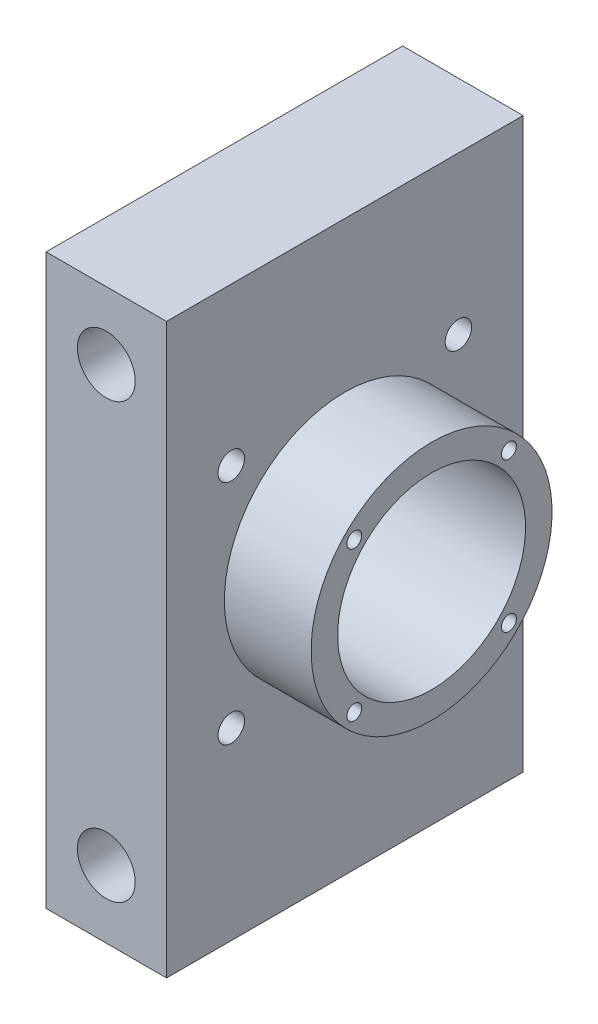
from build123d import *

# Parameters (mm, degrees)
BOSS_EXTRUDE1_DEPTH      = 320
SKETCH2_W                = 25
SKETCH2_H                = 100
BOSS_EXTRUDE2_DEPTH      = 50
CUT_EXTRUDE1_DEPTH       = 337.19190948
CUT_EXTRUDE1_DEPTH_BACK  = 337.19190948
SKETCH3_R                = 5
SKETCH4_W                = 150
SKETCH4_H                = 19.211352241
BOSS_EXTRUDE3_DEPTH      = 100
BOSS_EXTRUDE4_DEPTH      = 100
SKETCH6_W                = 42.1
SKETCH6_H                = 42.1
CUT_EXTRUDE2_DEPTH       = 10
SKETCH7_R                = 11
CUT_EXTRUDE3_DEPTH       = 2
CUT_EXTRUDE4_DEPTH       = 391.24267
CUT_EXTRUDE4_DEPTH_BACK  = 391.24267
SKETCH8_R                = 11
SKETCH10_R               = 25
SKETCH10_R_2             = 11
BOSS_EXTRUDE5_DEPTH      = 18
CUT_EXTRUDE6_DEPTH       = 381.347658714
CUT_EXTRUDE6_DEPTH_BACK  = 381.347658714
BOSS_EXTRUDE6_REACH      = 243.332
SKETCH12_W               = 150
SKETCH12_H               = 15
SKETCH13_W               = 165
SKETCH13_H               = 5
BOSS_EXTRUDE7_DEPTH      = 100
CUT_EXTRUDE7_DEPTH       = 282.821411126
CUT_EXTRUDE7_DEPTH_BACK  = 282.821411126
SKETCH16_W               = 62.5
SKETCH16_H               = 22.206056974
CUT_EXTRUDE9_DEPTH       = 298.574684732
SKETCH17_W               = 62.5
SKETCH17_H               = 5
BOSS_EXTRUDE8_DEPTH      = 15
SKETCH18_W               = 62.5
SKETCH18_H               = 11.362446971
BOSS_EXTRUDE9_DEPTH      = 15
SKETCH19_W               = 25
SKETCH19_H               = 100
BOSS_EXTRUDE11_DEPTH     = 9
SKETCH20_R               = 5
CUT_EXTRUDE10_DEPTH      = 62.5
SKETCH21_R               = 6
CUT_EXTRUDE11_DEPTH      = 62.5
CUT_EXTRUDE12_DEPTH      = 7
CUT_EXTRUDE14_DEPTH      = 261.438787644
CUT_EXTRUDE14_DEPTH_BACK = 261.438787644
SKETCH23_OUTSIDE_W       = 346.597
SKETCH23_OUTSIDE_H       = 164.386
SKETCH23_OUTSIDE_W_2     = 50
SKETCH23_OUTSIDE_H_2     = 100
CUT_EXTRUDE15_DEPTH      = 115.564392374
CUT_EXTRUDE15_DEPTH_BACK = 115.564392374
SKETCH24_R               = 6
SKETCH25_W               = 25
SKETCH25_H               = 5
BOSS_EXTRUDE12_DEPTH     = 50
SKETCH26_W               = 25
SKETCH26_H               = 4
BOSS_EXTRUDE13_DEPTH     = 50
CUT_EXTRUDE17_DEPTH      = 125.378454726
CUT_EXTRUDE17_DEPTH_BACK = 125.378454726
SKETCH27_R               = 1.55
SKETCH28_R               = 6
BOSS_EXTRUDE14_DEPTH     = 50
SKETCH29_R               = 5
CUT_EXTRUDE18_DEPTH      = 123.498979588
SKETCH30_R               = 5
BOSS_EXTRUDE15_DEPTH     = 50
SKETCH31_R               = 6
CUT_EXTRUDE19_DEPTH      = 123.498979588
SKETCH32_W               = 12
SKETCH32_H               = 118
BOSS_EXTRUDE17_DEPTH     = 25
SKETCH35_W               = 57
SKETCH35_H               = 57
CUT_EXTRUDE20_DEPTH      = 10
SKETCH36_R               = 19.5
CUT_EXTRUDE21_DEPTH      = 130.668808894
SKETCH37_R               = 2.75
CUT_EXTRUDE23_DEPTH      = 130.668808894
CUT_EXTRUDE24_DEPTH      = 135.096979832
CUT_EXTRUDE24_DEPTH_BACK = 135.096979832
SKETCH38_R               = 6
SKETCH39_W               = 57.5
SKETCH39_H               = 57.5
CUT_EXTRUDE25_DEPTH      = 10
SKETCH41_W               = 57.5
SKETCH41_H               = 57.5
CUT_EXTRUDE26_DEPTH      = 5


with BuildPart() as part:
    # Sketch1 → Boss-Extrude1 (new body)
    with BuildSketch(Plane.XY):
        Polygon((0, 100), (0, 85.5), (-5.5, 85.5), (-5.5, 92.241974104), (-11, 92.241974104), (-11, 13.345911947), (-5.5, 13.345911947), (-5.5, 20.087886052), (0, 20.087886052), (0, 5.587886052), (0, 0), (-25, 0), (-25, 100), align=None)
    extrude(amount=BOSS_EXTRUDE1_DEPTH)

    # Sketch2 → Boss-Extrude2 (add)
    with BuildSketch(Plane(origin=(0, 0, 0), x_dir=(-1, 0, 0), z_dir=(0, 0, -1))):
        with Locations((12.5, 50)):
            Rectangle(SKETCH2_W, SKETCH2_H)
    extrude(amount=BOSS_EXTRUDE2_DEPTH)

    # Sketch3 → Cut-Extrude1 (cut, two sides: drawn at the far end of the back side and taken through both)
    with BuildSketch(Plane(origin=(0, 0, 0), x_dir=(0, 0, -1), z_dir=(1, 0, 0)).offset(-CUT_EXTRUDE1_DEPTH_BACK)):
        with Locations(Location((25, 52.793943026, 0), (0, 0, 90))):
            Circle(SKETCH3_R)
    extrude(amount=CUT_EXTRUDE1_DEPTH + CUT_EXTRUDE1_DEPTH_BACK, mode=Mode.SUBTRACT)

    # Sketch4 → Boss-Extrude3 (add)
    with BuildSketch(Plane(origin=(0, 100, 0), x_dir=(1, 0, 0), z_dir=(0, 1, 0))):
        with Locations((50, -329.60567612)):
            Rectangle(SKETCH4_W, SKETCH4_H)
    extrude(amount=-BOSS_EXTRUDE3_DEPTH)

    # Sketch5 → Boss-Extrude4 (add)
    with BuildSketch(Plane(origin=(0, 0, 0), x_dir=(1, 0, 0), z_dir=(0, 1, 0))):
        Polygon((125, -209.211352241), (125, -339.211352241), (127.245354701, -339.211352241), (140, -339.211352241), (140, -209.211352241), align=None)
    extrude(amount=BOSS_EXTRUDE4_DEPTH)

    # Sketch6 → Cut-Extrude2 (cut)
    with BuildSketch(Plane.ZY.offset(25)):
        with Locations((-25, 52.793943026)):
            Rectangle(SKETCH6_W, SKETCH6_H)
    extrude(amount=-CUT_EXTRUDE2_DEPTH, mode=Mode.SUBTRACT)

    # Sketch7 → Cut-Extrude3 (cut)
    with BuildSketch(Plane.ZY.offset(15)):
        with Locations(Location((-25, 52.793943026, 0), (0, 0, 270))):
            Circle(SKETCH7_R)
    extrude(amount=-CUT_EXTRUDE3_DEPTH, mode=Mode.SUBTRACT)

    # Sketch8 → Cut-Extrude4 (cut, two sides: drawn at the far end of the back side and taken through both)
    with BuildSketch(Plane.ZY.offset(25).offset(-CUT_EXTRUDE4_DEPTH_BACK)):
        with Locations(Location((-25, 52.793943026, 0), (0, 0, 270))):
            Circle(SKETCH8_R)
    extrude(amount=CUT_EXTRUDE4_DEPTH + CUT_EXTRUDE4_DEPTH_BACK, mode=Mode.SUBTRACT)

    # Sketch10 → Boss-Extrude5 (add)
    with BuildSketch(Plane(origin=(0, 0, 0), x_dir=(0, 0, -1), z_dir=(1, 0, 0))):
        with Locations((25, 52.793943026)):
            Circle(SKETCH10_R)
        with Locations(Location((25, 52.793943026, 0), (0, 0, 270))):
            Circle(SKETCH10_R_2, mode=Mode.SUBTRACT)
    extrude(amount=BOSS_EXTRUDE5_DEPTH)

    # Sketch11 → Cut-Extrude6 (cut, two sides: drawn at the far end of the back side and taken through both)
    with BuildSketch(Plane(origin=(0, 0, 0), x_dir=(1, 0, 0), z_dir=(0, 1, 0)).offset(-CUT_EXTRUDE6_DEPTH_BACK)):
        Polygon((-25, -339.211352241), (-25, -218.211352241), (83.728432641, -218.211352241), (83.728432641, -190.050980202), (162.673418017, -190.050980202), (162.673418017, -339.211352241), align=None)
    extrude(amount=CUT_EXTRUDE6_DEPTH + CUT_EXTRUDE6_DEPTH_BACK, mode=Mode.SUBTRACT)

    # Boss-Extrude6: up to this face of the body (flat: up to its plane)
    boss_extrude6_end = Plane(part.part.faces().sort_by_distance((-12.5, 100, 84.10567612))[0])
    # Sketch12 → Boss-Extrude6 (add, up to the picked face)
    with BuildSketch(Plane(origin=(0, 0, 0), x_dir=(1, 0, 0), z_dir=(0, 1, 0)), mode=Mode.PRIVATE) as boss_extrude6_sk1:
        with Locations((50, -210.711352241)):
            Rectangle(SKETCH12_W, SKETCH12_H)
    boss_extrude6_tool1 = split(extrude(boss_extrude6_sk1.sketch, amount=BOSS_EXTRUDE6_REACH, mode=Mode.PRIVATE), bisect_by=boss_extrude6_end, keep=Keep.BOTH, mode=Mode.PRIVATE)
    # Sketch12 → Boss-Extrude6 (add, up to the picked face)
    with BuildSketch(Plane(origin=(0, 0, 0), x_dir=(1, 0, 0), z_dir=(0, 1, 0)), mode=Mode.PRIVATE) as boss_extrude6_sk2:
        Polygon((140, -118.211352241), (125, -118.211352241), (125, -203.211352241), (125, -218.211352241), (140, -218.211352241), align=None)
    boss_extrude6_tool2 = split(extrude(boss_extrude6_sk2.sketch, amount=BOSS_EXTRUDE6_REACH, mode=Mode.PRIVATE), bisect_by=boss_extrude6_end, keep=Keep.BOTH, mode=Mode.PRIVATE)
    add(boss_extrude6_tool1.solids().sort_by(Axis((50, 0, 210.711352), (0, 1, 0)))[0])
    add(boss_extrude6_tool2.solids().sort_by(Axis((132.5, 0, 168.211352), (0, 1, 0)))[0])

    # Sketch13 → Boss-Extrude7 (add)
    with BuildSketch(Plane(origin=(0, 0, 0), x_dir=(1, 0, 0), z_dir=(0, 1, 0))):
        with Locations((57.5, -220.711352241)):
            Rectangle(SKETCH13_W, SKETCH13_H)
    extrude(amount=BOSS_EXTRUDE7_DEPTH)

    # Sketch14 → Cut-Extrude7 (cut, two sides: drawn at the far end of the back side and taken through both)
    with BuildSketch(Plane(origin=(0, 0, 0), x_dir=(1, 0, 0), z_dir=(0, 1, 0)).offset(-CUT_EXTRUDE7_DEPTH_BACK)):
        Polygon((62.5, -203.211352241), (62.5, -244.24795379), (164.214361429, -244.24795379), (164.214361429, -100.335073146), (62.5, -100.335073146), align=None)
    extrude(amount=CUT_EXTRUDE7_DEPTH + CUT_EXTRUDE7_DEPTH_BACK, mode=Mode.SUBTRACT)

    # Sketch16 → Cut-Extrude9 (cut, through all)
    with BuildSketch(Plane.XY.offset(223.211352241)):
        with Locations((31.25, 88.896971513)):
            Rectangle(SKETCH16_W, SKETCH16_H)
        with Locations((31.25, 11.103028487)):
            Rectangle(SKETCH16_W, SKETCH16_H)
    extrude(amount=-CUT_EXTRUDE9_DEPTH, mode=Mode.SUBTRACT)

    # Sketch17 → Boss-Extrude8 (add)
    with BuildSketch(Plane(origin=(0, 77.793943026, 0), x_dir=(1, 0, 0), z_dir=(0, 1, 0))):
        with Locations((31.25, -210.711352241)):
            Rectangle(SKETCH17_W, SKETCH17_H)
        with Locations((31.25, -215.711352241)):
            Rectangle(SKETCH17_W, SKETCH17_H)
    extrude(amount=BOSS_EXTRUDE8_DEPTH)

    # Sketch18 → Boss-Extrude9 (add)
    with BuildSketch(Plane.XZ.offset(-22.206056974)):
        with Locations((31.25, 213.211352241)):
            Rectangle(SKETCH18_W, SKETCH18_H)
    extrude(amount=BOSS_EXTRUDE9_DEPTH)

    # Sketch19 → Boss-Extrude11 (add)
    with BuildSketch(Plane.XY.offset(223.211352241)):
        with Locations((-12.5, 50)):
            Rectangle(SKETCH19_W, SKETCH19_H)
    extrude(amount=BOSS_EXTRUDE11_DEPTH)

    # Sketch20 → Cut-Extrude10 (cut)
    with BuildSketch(Plane(origin=(62.5, 0, 0), x_dir=(0, 0, -1), z_dir=(1, 0, 0))):
        with Locations((-213.211352241, 50)):
            Circle(SKETCH20_R)
    extrude(amount=-CUT_EXTRUDE10_DEPTH, mode=Mode.SUBTRACT)

    # Sketch21 → Cut-Extrude11 (cut)
    with BuildSketch(Plane(origin=(62.5, 0, 0), x_dir=(0, 0, -1), z_dir=(1, 0, 0))):
        with Locations((-213.211352241, 50)):
            Circle(SKETCH21_R)
    extrude(amount=-CUT_EXTRUDE11_DEPTH, mode=Mode.SUBTRACT)

    # Sketch22 → Cut-Extrude12 (cut)
    with BuildSketch(Plane(origin=(62.5, 0, 0), x_dir=(0, 0, -1), z_dir=(1, 0, 0))):
        Polygon((-204.611352241, 45.034787685), (-204.611352241, 54.965212315), (-213.211352241, 59.93042463), (-221.811352241, 54.965212315), (-221.811352241, 45.034787685), (-213.211352241, 40.06957537), align=None)
    extrude(amount=-CUT_EXTRUDE12_DEPTH, mode=Mode.SUBTRACT)

    # Sketch23 outside → Cut-Extrude14 (cut, two sides: drawn at the far end of the back side and taken through both)
    with BuildSketch(Plane(origin=(0, 0, 0), x_dir=(0, 0, -1), z_dir=(1, 0, 0)).offset(-CUT_EXTRUDE14_DEPTH_BACK)):
        with Locations((-91.1055, 50)):
            Rectangle(SKETCH23_OUTSIDE_W, SKETCH23_OUTSIDE_H)
        with Locations((25, 50)):
            Rectangle(SKETCH23_OUTSIDE_W_2, SKETCH23_OUTSIDE_H_2, mode=Mode.SUBTRACT)
    extrude(amount=CUT_EXTRUDE14_DEPTH + CUT_EXTRUDE14_DEPTH_BACK, mode=Mode.SUBTRACT)

    # Sketch24 → Cut-Extrude15 (cut, two sides: drawn at the far end of the back side and taken through both)
    with BuildSketch(Plane.XY.offset(-CUT_EXTRUDE15_DEPTH_BACK)):
        with Locations((-12.5, 90)):
            Circle(SKETCH24_R)
        with Locations(Location((-12.5, 10, 0), (0, 0, 180))):
            Circle(SKETCH24_R)
    extrude(amount=CUT_EXTRUDE15_DEPTH + CUT_EXTRUDE15_DEPTH_BACK, mode=Mode.SUBTRACT)

    # Sketch25 → Boss-Extrude12 (add)
    with BuildSketch(Plane.XY):
        with Locations((-12.5, 102.5)):
            Rectangle(SKETCH25_W, SKETCH25_H)
        with Locations((-12.5, -2.5)):
            Rectangle(SKETCH25_W, SKETCH25_H)
    extrude(amount=-BOSS_EXTRUDE12_DEPTH)

    # Sketch26 → Boss-Extrude13 (add)
    with BuildSketch(Plane.XY):
        with Locations((-12.5, -7)):
            Rectangle(SKETCH26_W, SKETCH26_H)
        with Locations((-12.5, 107)):
            Rectangle(SKETCH26_W, SKETCH26_H)
    extrude(amount=-BOSS_EXTRUDE13_DEPTH)

    # Sketch27 → Cut-Extrude17 (cut, two sides: drawn at the far end of the back side and taken through both)
    with BuildSketch(Plane.ZY.offset(15).offset(-CUT_EXTRUDE17_DEPTH_BACK)):
        with Locations(Location((-8.954662436, 68.293943026, 0), (0, 0, 270))):
            Circle(SKETCH27_R)
        with Locations(Location((-41.045337564, 68.293943026, 0), (0, 0, 270))):
            Circle(SKETCH27_R)
        with Locations(Location((-41.045337564, 37.293943026, 0), (0, 0, 270))):
            Circle(SKETCH27_R)
        with Locations(Location((-8.954662436, 37.293943026, 0), (0, 0, 270))):
            Circle(SKETCH27_R)
    extrude(amount=CUT_EXTRUDE17_DEPTH + CUT_EXTRUDE17_DEPTH_BACK, mode=Mode.SUBTRACT)

    # Sketch28 → Boss-Extrude14 (add)
    with BuildSketch(Plane.XY):
        with Locations((-12.5, 90)):
            Circle(SKETCH28_R)
        with Locations((-12.5, 10)):
            Circle(SKETCH28_R)
    extrude(amount=-BOSS_EXTRUDE14_DEPTH)

    # Sketch29 → Cut-Extrude18 (cut, through all)
    with BuildSketch(Plane.XY):
        with Locations((-12.5, 99)):
            Circle(SKETCH29_R)
        with Locations(Location((-12.5, 1, 0), (0, 0, 180))):
            Circle(SKETCH29_R)
    extrude(amount=-CUT_EXTRUDE18_DEPTH, mode=Mode.SUBTRACT)

    # Sketch30 → Boss-Extrude15 (add)
    with BuildSketch(Plane.XY):
        with Locations((-12.5, 99)):
            Circle(SKETCH30_R)
        with Locations((-12.5, 1)):
            Circle(SKETCH30_R)
    extrude(amount=-BOSS_EXTRUDE15_DEPTH)

    # Sketch31 → Cut-Extrude19 (cut, through all)
    with BuildSketch(Plane.XY):
        with Locations((-12.5, 95)):
            Circle(SKETCH31_R)
        with Locations((-12.5, 5)):
            Circle(SKETCH31_R)
    extrude(amount=-CUT_EXTRUDE19_DEPTH, mode=Mode.SUBTRACT)

    # Sketch32 → Boss-Extrude17 (add)
    with BuildSketch(Plane.ZY.offset(25)):
        with Locations((6, 50)):
            Rectangle(SKETCH32_W, SKETCH32_H)
        with Locations((-56, 50)):
            Rectangle(SKETCH32_W, SKETCH32_H)
    extrude(amount=-BOSS_EXTRUDE17_DEPTH)

    # Sketch35 → Cut-Extrude20 (cut)
    with BuildSketch(Plane.ZY.offset(25)):
        with Locations((-25, 52.793943026)):
            Rectangle(SKETCH35_W, SKETCH35_H)
    extrude(amount=-CUT_EXTRUDE20_DEPTH, mode=Mode.SUBTRACT)

    # Sketch36 → Cut-Extrude21 (cut, through all)
    with BuildSketch(Plane.ZY.offset(15)):
        with Locations(Location((-25, 52.793943026, 0), (0, 0, 270))):
            Circle(SKETCH36_R)
    extrude(amount=-CUT_EXTRUDE21_DEPTH, mode=Mode.SUBTRACT)

    # Sketch37 → Cut-Extrude23 (cut, through all)
    with BuildSketch(Plane.ZY.offset(15)):
        with Locations(Location((-48.57, 76.363943026, 0), (0, 0, 270))):
            Circle(SKETCH37_R)
        with Locations(Location((-1.43, 76.363943026, 0), (0, 0, 270))):
            Circle(SKETCH37_R)
        with Locations(Location((-1.43, 29.223943026, 0), (0, 0, 270))):
            Circle(SKETCH37_R)
        with Locations(Location((-48.57, 29.223943026, 0), (0, 0, 270))):
            Circle(SKETCH37_R)
    extrude(amount=-CUT_EXTRUDE23_DEPTH, mode=Mode.SUBTRACT)

    # Sketch38 → Cut-Extrude24 (cut, two sides: drawn at the far end of the back side and taken through both)
    with BuildSketch(Plane.XY.offset(12).offset(-CUT_EXTRUDE24_DEPTH_BACK)):
        with Locations((-12.5, 95)):
            Circle(SKETCH38_R)
        with Locations((-12.5, 5)):
            Circle(SKETCH38_R)
    extrude(amount=CUT_EXTRUDE24_DEPTH + CUT_EXTRUDE24_DEPTH_BACK, mode=Mode.SUBTRACT)

    # Sketch39 → Cut-Extrude25 (cut)
    with BuildSketch(Plane.ZY.offset(25)):
        with Locations((-25, 52.793943026)):
            Rectangle(SKETCH39_W, SKETCH39_H)
    extrude(amount=-CUT_EXTRUDE25_DEPTH, mode=Mode.SUBTRACT)

    # Sketch41 → Cut-Extrude26 (cut)
    with BuildSketch(Plane.ZY.offset(15)):
        with Locations((-25, 52.793943026)):
            Rectangle(SKETCH41_W, SKETCH41_H)
    extrude(amount=-CUT_EXTRUDE26_DEPTH, mode=Mode.SUBTRACT)


solid = part.part
